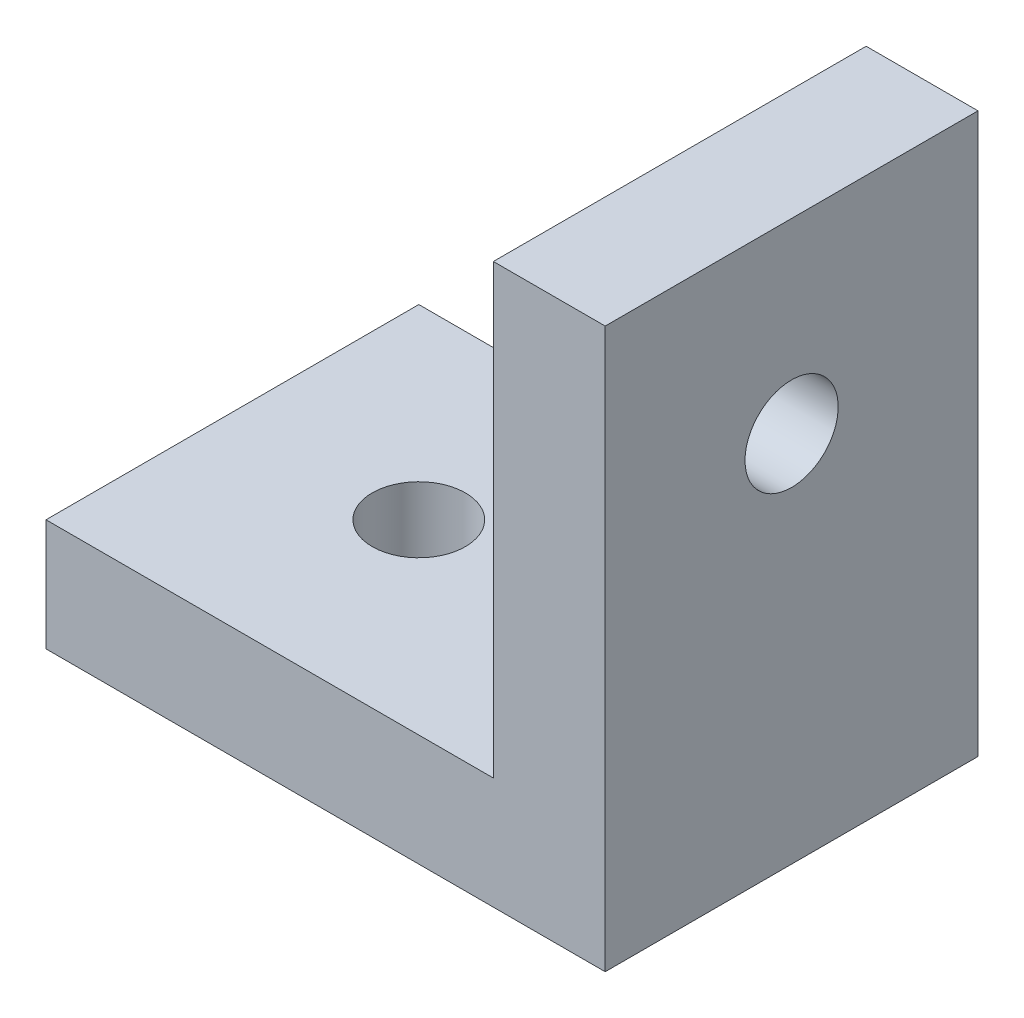
from build123d import *

# Parameters (mm, degrees)
SKETCH_1_W                   = 15
SKETCH_1_H                   = 10
EXTRUDE_1_DEPTH              = 3
SKETCH_2_W                   = 3
SKETCH_2_H                   = 10
EXTRUDE_2_DEPTH              = 12
HOLE_WIZARD_M3_1_D           = 2.5
HOLE_WIZARD_M3_1_ON_FACE_2_D = 2.5


with BuildPart() as part:
    # 草圖1 → 填料-伸長1 (new body)
    with BuildSketch(Plane(origin=(0, 0, 0), x_dir=(1, 0, 0), z_dir=(0, 1, 0))):
        Rectangle(SKETCH_1_W, SKETCH_1_H)
    extrude(amount=EXTRUDE_1_DEPTH)

    # 草圖2 → 填料-伸長2 (add)
    with BuildSketch(Plane(origin=(0, 3, 0), x_dir=(1, 0, 0), z_dir=(0, 1, 0))):
        with Locations((6, 0)):
            Rectangle(SKETCH_2_W, SKETCH_2_H)
    extrude(amount=EXTRUDE_2_DEPTH)

    # M3  螺絲攻的螺孔鑽1 (through all)
    with Locations(Plane(origin=(4.5, 10, 0), x_dir=(0, 0, -1), z_dir=(-1, 0, 0))):
        with Locations((0, 0)):
            Hole(HOLE_WIZARD_M3_1_D / 2)

    # M3  螺絲攻的螺孔鑽1 on face 2 (through all)
    with Locations(Plane(origin=(-2.5, 3, 0), x_dir=(0, 0, 1), z_dir=(0, 1, 0))):
        with Locations((0, 0)):
            Hole(HOLE_WIZARD_M3_1_ON_FACE_2_D / 2)


solid = part.part
